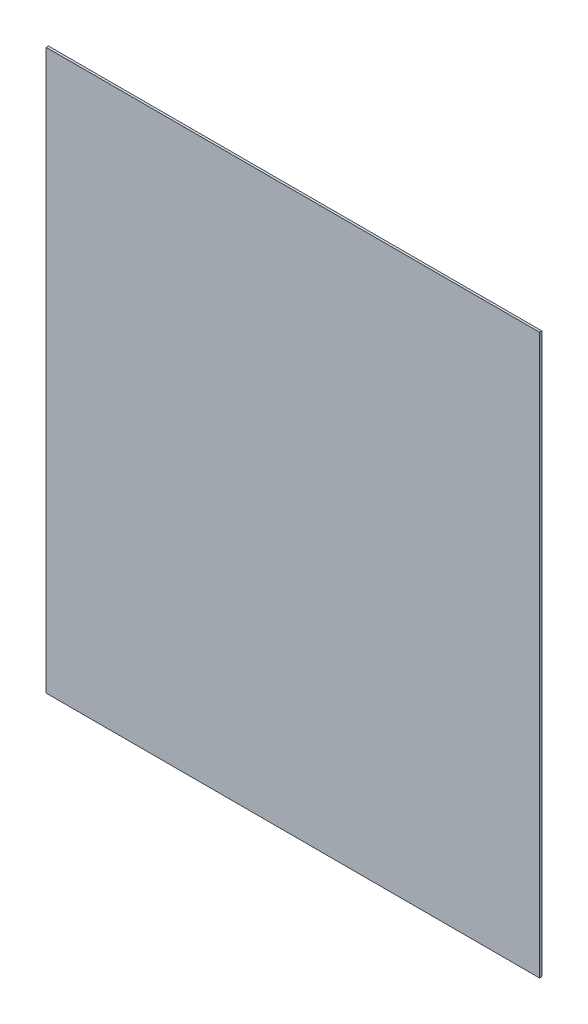
from build123d import *

# Parameters (mm, degrees)
SKETCH1_W           = 533.4
SKETCH1_H           = 604.52
BOSS_EXTRUDE1_DEPTH = 2.54


with BuildPart() as part:
    # Sketch1 → Boss-Extrude1 (new body)
    with BuildSketch(Plane.XY):
        Rectangle(SKETCH1_W, SKETCH1_H)
    extrude(amount=BOSS_EXTRUDE1_DEPTH)


solid = part.part
